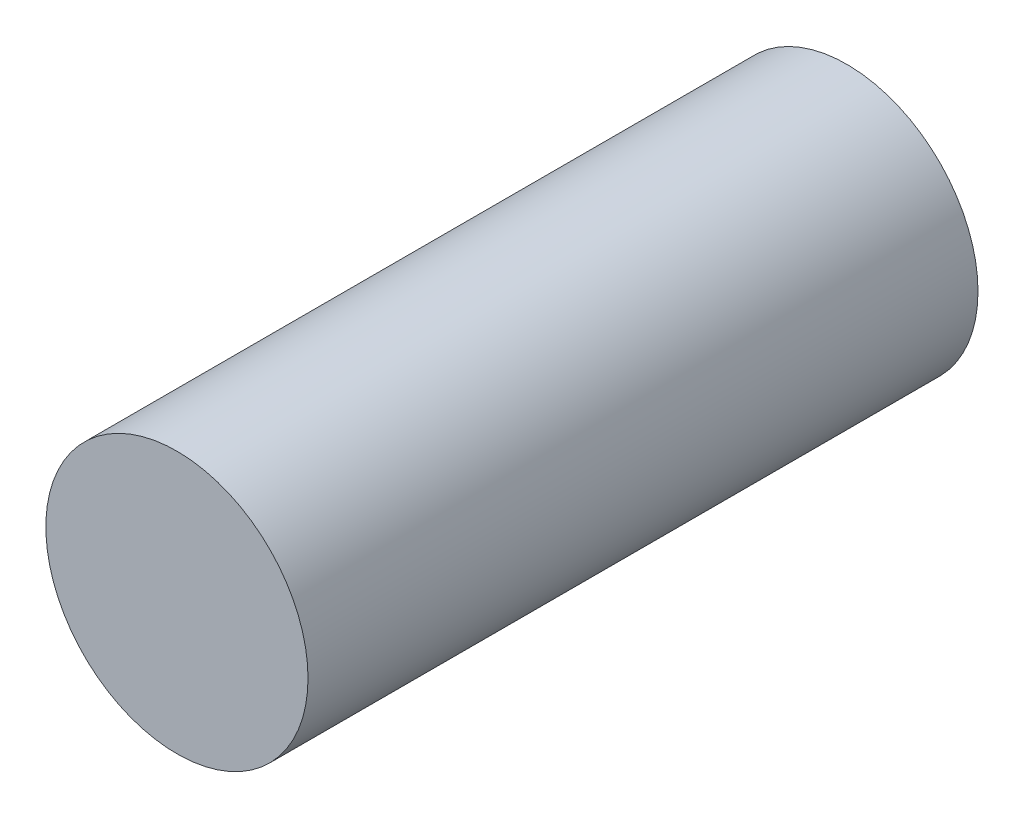
from build123d import *

# Parameters (mm, degrees)
V09_LASER_D9_L23_START = -23
SKETCH_3_R             = 4.5
V09_LASER_D9_L23_DEPTH = 23


with BuildPart() as part:
    # 草图3 → V09_Laser_D9_L23 (new body)
    with BuildSketch(Plane.XY.offset(V09_LASER_D9_L23_START)):
        with Locations((0, 14)):
            Circle(SKETCH_3_R)
    extrude(amount=V09_LASER_D9_L23_DEPTH)


solid = part.part
